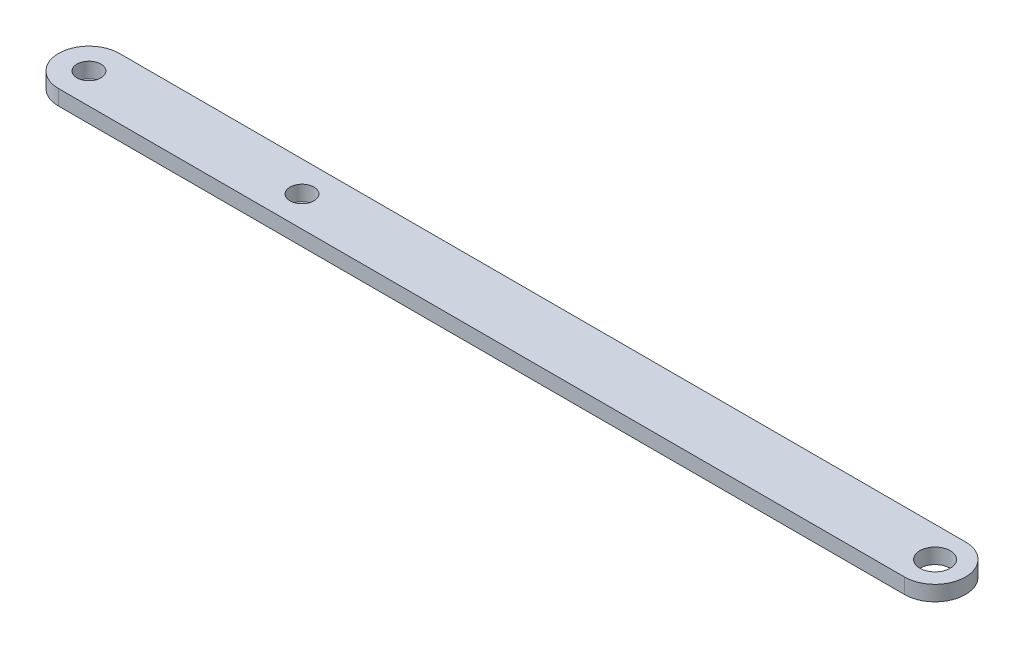
from build123d import *

# Parameters (mm, degrees)
SKETCH1_R           = 2.5
SKETCH1_R_2         = 3.175
BOSS_EXTRUDE1_DEPTH = 3.175


with BuildPart() as part:
    # Sketch1 → Boss-Extrude1 (new body)
    with BuildSketch(Plane(origin=(0, 0, 0), x_dir=(1, 0, 0), z_dir=(0, 1, 0))):
        with BuildLine():
            Line((0, 6.35), (176.54778, 6.35))
            ThreePointArc((176.54778, 6.35), (182.89778, 0), (176.54778, -6.35))
            Line((176.54778, -6.35), (0, -6.35))
            ThreePointArc((0, -6.35), (-6.35, 0), (0, 6.35))
        make_face()
        with Locations(Location((0, 0, 0), (0, 0, 270))):
            Circle(SKETCH1_R, mode=Mode.SUBTRACT)
        with Locations(Location((44.45, 0, 0), (0, 0, 270))):
            Circle(SKETCH1_R, mode=Mode.SUBTRACT)
        with Locations(Location((176.54778, 0, 0), (0, 0, 270))):
            Circle(SKETCH1_R_2, mode=Mode.SUBTRACT)
    extrude(amount=BOSS_EXTRUDE1_DEPTH)


solid = part.part
